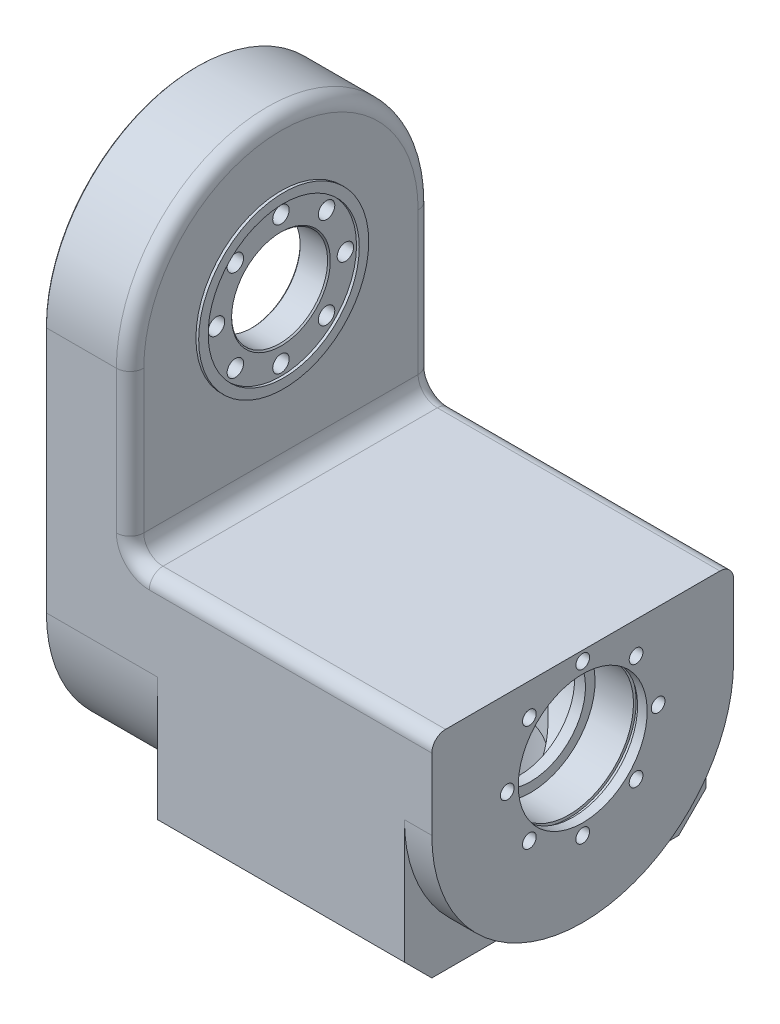
from build123d import *

# Parameters (mm, degrees)
EXTRUDE_1_DEPTH                = 41
EXTRUDE_2_DEPTH                = 90
EXTRUDE_3_DEPTH                = 10
CUT_EXTRUDE_1_DEPTH            = 182.400110254
CUT_EXTRUDE_1_DEPTH_BACK       = 182.400110254
SKETCH_4_W                     = 10
SKETCH_4_H                     = 114
SKETCH_5_R                     = 31
SKETCH_5_R_2                   = 27.55
EXTRUDE_4_DEPTH                = 1
CUT_EXTRUDE_2_DEPTH            = 20
SKETCH_7_R                     = 2
CUT_EXTRUDE_3_DEPTH            = 12
CUT_EXTRUDE_4_REACH            = 206.893
SKETCH_8_R                     = 5
SKETCH_10_R                    = 17.5
CUT_EXTRUDE_5_DEPTH            = 167.330995308
PATTERN_CIRCULAR_1_COUNT       = 8
SKETCH_14_R                    = 2.5
CUT_EXTRUDE_6_DEPTH            = 15
SKETCH_15_R                    = 34
CUT_EXTRUDE_7_DEPTH            = 25
SKETCH_16_R                    = 30
CUT_EXTRUDE_8_DEPTH            = 25
SKETCH_17_R                    = 2.5
CUT_EXTRUDE_9_DEPTH            = 15
HOLE_WIZARD_M1_6_2_D           = 4
HOLE_WIZARD_M1_6_2_DEPTH       = 30
HOLE_WIZARD_M1_6_2_CBORE_D     = 10
HOLE_WIZARD_M1_6_2_CBORE_DEPTH = 12
HOLE_WIZARD_M1_6_2_TIP         = 1.201721238
FILLET_2_R                     = 7
FILLET_1_R                     = 5
CHAMFER_1_SIZE                 = 0.5


with BuildPart() as part:
    # 草图1 → 凸台-拉伸1 (new body)
    with BuildSketch(Plane(origin=(0, 0, 0), x_dir=(0, 0, -1), z_dir=(1, 0, 0))):
        with BuildLine():
            Line((55, 45), (55, -45))
            ThreePointArc((55, -45), (0, -100), (-55, -45))
            Line((-55, -45), (-55, 45))
            ThreePointArc((-55, 45), (0, 100), (55, 45))
        make_face()
    extrude(amount=EXTRUDE_1_DEPTH)

    # 草图2 → 凸台-拉伸2 (add)
    with BuildSketch(Plane(origin=(41, 0, 0), x_dir=(0, 0, -1), z_dir=(1, 0, 0))):
        Polygon((-55, -14), (55, -14), (55, -90), (45, -100), (-45, -100), (-55, -90), align=None)
    extrude(amount=EXTRUDE_2_DEPTH)

    # 草图3 → 凸台-拉伸3 (add)
    with BuildSketch(Plane(origin=(131, 0, 0), x_dir=(0, 0, -1), z_dir=(1, 0, 0))):
        with BuildLine():
            Line((55, -14), (-55, -14))
            Line((-55, -14), (-55, -45))
            ThreePointArc((-55, -45), (-38.890872965, -83.890872965), (0, -100))
            ThreePointArc((0, -100), (38.890872965, -83.890872965), (55, -45))
            Line((55, -45), (55, -14))
        make_face()
    extrude(amount=EXTRUDE_3_DEPTH)

    # 草图4 → 切除-拉伸1 (cut, two sides: drawn at the far end of the back side and taken through both)
    with BuildSketch(Plane.XY.offset(-CUT_EXTRUDE_1_DEPTH_BACK)):
        with Locations((36, 43)):
            Rectangle(SKETCH_4_W, SKETCH_4_H)
    extrude(amount=CUT_EXTRUDE_1_DEPTH + CUT_EXTRUDE_1_DEPTH_BACK, mode=Mode.SUBTRACT)

    # 草图5 → 凸台-拉伸4 (add)
    with BuildSketch(Plane(origin=(31, 0, 0), x_dir=(0, 0, -1), z_dir=(1, 0, 0))):
        with Locations(Location((0, 45, 0), (0, 0, 180))):
            Circle(SKETCH_5_R)
        with Locations((0, 45)):
            Circle(SKETCH_5_R_2, mode=Mode.SUBTRACT)
    extrude(amount=EXTRUDE_4_DEPTH)

    # 草图6 → 切除-拉伸2 (cut)
    with BuildSketch(Plane.ZY):
        with BuildLine():
            Line((47.75, 45), (47.75, -45))
            ThreePointArc((47.75, -45), (0, -92.75), (-47.75, -45))
            Line((-47.75, -45), (-47.75, 45))
            ThreePointArc((-47.75, 45), (0, 92.75), (47.75, 45))
        make_face()
    extrude(amount=-CUT_EXTRUDE_2_DEPTH, mode=Mode.SUBTRACT)

    # 草图7 → 切除-拉伸3 (cut)
    with BuildSketch(Plane.ZY):
        with Locations((0, 96)):
            Circle(SKETCH_7_R)
        with Locations((-51, 45)):
            Circle(SKETCH_7_R)
        with Locations((51, 45)):
            Circle(SKETCH_7_R)
        with Locations(Location((51, -45, 0), (0, 0, 180))):
            Circle(SKETCH_7_R)
        with Locations(Location((-51, -45, 0), (0, 0, 180))):
            Circle(SKETCH_7_R)
        with Locations(Location((0, -96, 0), (0, 0, 180))):
            Circle(SKETCH_7_R)
    extrude(amount=-CUT_EXTRUDE_3_DEPTH, mode=Mode.SUBTRACT)

    # 草图8 → 切除-拉伸4 (cut, up to next)
    with BuildSketch(Plane(origin=(0, 0, -55), x_dir=(-1, 0, 0), z_dir=(0, 0, -1)), mode=Mode.PRIVATE) as cut_extrude_4_sk1:
        with Locations((-10, 0)):
            Circle(SKETCH_8_R)
    cut_extrude_4_tool1 = extrude(cut_extrude_4_sk1.sketch, amount=-CUT_EXTRUDE_4_REACH, mode=Mode.PRIVATE) & part.part
    add(cut_extrude_4_tool1.solids().sort_by_distance((10, 0, -55))[0], mode=Mode.SUBTRACT)

    # 草图10 → 切除-拉伸5 (cut, through all)
    with BuildSketch(Plane.ZY.offset(-20)):
        with Locations((0, 45)):
            Circle(SKETCH_10_R)
    extrude(amount=-CUT_EXTRUDE_5_DEPTH, mode=Mode.SUBTRACT)

    # 草图12 → M1.6 六角头螺栓的柱形沉头孔1 (revolve, cut)
    with BuildSketch(Plane(origin=(20, 68.5, 0), x_dir=(0, 0, 1), z_dir=(0, 1, 0))):
        Polygon((0, 0), (0, 16.802581857), (3, 15), (3, 6), (5, 6), (5, 0), align=None)
    hole_wizard_m1_6_1 = revolve(axis=Axis((13.65, 68.5, 0), (1, 0, 0)), mode=Mode.SUBTRACT)

    # 阵列(圆周)1: M1.6 六角头螺栓的柱形沉头孔1 ×8 about axis
    pattern_circular_1_axis = Axis((0, 45, 0), (1, 0, 0))
    for i in range(1, PATTERN_CIRCULAR_1_COUNT):
        add(hole_wizard_m1_6_1.rotate(pattern_circular_1_axis, i * 360 / PATTERN_CIRCULAR_1_COUNT), mode=Mode.SUBTRACT)

    # 草图13 → 切除-旋转1 (revolve, cut)
    with BuildSketch(Plane.XY, mode=Mode.PRIVATE) as cut_revolve_1_sk:
        Polygon((20, -45), (20, -14), (30, -14), (30, -17.5), (118, -17.5), (118, -25), (122, -25), (122, -21.5), (136, -21.5), (136, -20.5), (137.5, -20.5), (137.5, -21.5), (141, -21.5), (141, -45), align=None)
    revolve(cut_revolve_1_sk.sketch.rotate(Axis((20, -45, 0), (1, 0, 0)), 180), axis=Axis((20, -45, 0), (1, 0, 0)), mode=Mode.SUBTRACT)

    # 草图14 → 切除-拉伸6 (cut)
    with BuildSketch(Plane(origin=(141, 0, 0), x_dir=(0, 0, -1), z_dir=(1, 0, 0))):
        with Locations((0, -17.5)):
            Circle(SKETCH_14_R)
        with Locations((19.445436483, -25.554563517)):
            Circle(SKETCH_14_R)
        with Locations((27.5, -45)):
            Circle(SKETCH_14_R)
        with Locations((19.445436483, -64.445436483)):
            Circle(SKETCH_14_R)
        with Locations((0, -72.5)):
            Circle(SKETCH_14_R)
        with Locations((-19.445436483, -64.445436483)):
            Circle(SKETCH_14_R)
        with Locations((-27.5, -45)):
            Circle(SKETCH_14_R)
        with Locations((-19.445436483, -25.554563517)):
            Circle(SKETCH_14_R)
    extrude(amount=-CUT_EXTRUDE_6_DEPTH, mode=Mode.SUBTRACT)

    # 草图15 → 切除-拉伸7 (cut)
    with BuildSketch(Plane.XZ.offset(100)):
        with Locations(Location((86, 0, 0), (0, 0, 270))):
            Circle(SKETCH_15_R)
    extrude(amount=-CUT_EXTRUDE_7_DEPTH, mode=Mode.SUBTRACT)

    # 草图16 → 切除-拉伸8 (cut)
    with BuildSketch(Plane.XZ.offset(75)):
        with Locations(Location((86, 0, 0), (0, 0, 270))):
            Circle(SKETCH_16_R)
    extrude(amount=-CUT_EXTRUDE_8_DEPTH, mode=Mode.SUBTRACT)

    # 草图17 → 切除-拉伸9 (cut)
    with BuildSketch(Plane.XZ.offset(100)):
        with Locations(Location((86, 40, 0), (0, 0, 270))):
            Circle(SKETCH_17_R)
        with Locations(Location((114.284271247, 28.284271247, 0), (0, 0, 270))):
            Circle(SKETCH_17_R)
        with Locations(Location((126, 0, 0), (0, 0, 270))):
            Circle(SKETCH_17_R)
        with Locations(Location((114.284271247, -28.284271247, 0), (0, 0, 270))):
            Circle(SKETCH_17_R)
        with Locations(Location((86, -40, 0), (0, 0, 270))):
            Circle(SKETCH_17_R)
        with Locations(Location((57.715728753, -28.284271247, 0), (0, 0, 270))):
            Circle(SKETCH_17_R)
        with Locations(Location((46, 0, 0), (0, 0, 270))):
            Circle(SKETCH_17_R)
        with Locations(Location((57.715728753, 28.284271247, 0), (0, 0, 270))):
            Circle(SKETCH_17_R)
    extrude(amount=-CUT_EXTRUDE_9_DEPTH, mode=Mode.SUBTRACT)

    # M1.6 六角头螺栓的柱形沉头孔2
    with Locations(Plane(origin=(0, 0, -55), x_dir=(-1, 0, 0), z_dir=(0, 0, -1))):
        with Locations((-86, -45)):
            CounterBoreHole(HOLE_WIZARD_M1_6_2_D / 2, HOLE_WIZARD_M1_6_2_CBORE_D / 2, HOLE_WIZARD_M1_6_2_CBORE_DEPTH, depth=HOLE_WIZARD_M1_6_2_DEPTH)
            with Locations((0, 0, -(HOLE_WIZARD_M1_6_2_DEPTH + HOLE_WIZARD_M1_6_2_TIP / 2))):  # 118° drill point
                Cone(0, HOLE_WIZARD_M1_6_2_D / 2, HOLE_WIZARD_M1_6_2_TIP, mode=Mode.SUBTRACT)

    # 圆角2
    fillet_2_edges = [part.edges().sort_by_distance(p)[0] for p in [
        (31, -14, 0),
    ]]
    fillet(fillet_2_edges, radius=FILLET_2_R)

    # 圆角1
    fillet_1_edges = [part.edges().sort_by_distance(p)[0] for p in [
        (89.5, -14, 55),
        (89.5, -14, -55),
        (33.050252532, -11.949747468, 55),
        (33.050252532, -11.949747468, -55),
        (31, 100, 0),
        (31, 19, -55),
        (31, 19, 55),
    ]]
    fillet(fillet_1_edges, radius=FILLET_1_R)

    # 倒角1
    chamfer_1_edges = [part.edges().sort_by_distance(p)[0] for p in [
        (31, 45, -17.5),
        (20, 45, -17.5),
        (20, -14, 0),
        (86, -100, 34),
        (0, 0, -55),
        (0, -100, 0),
        (0, 0, 55),
        (0, 100, 0),
    ]]
    chamfer(chamfer_1_edges, length=CHAMFER_1_SIZE)


solid = part.part
